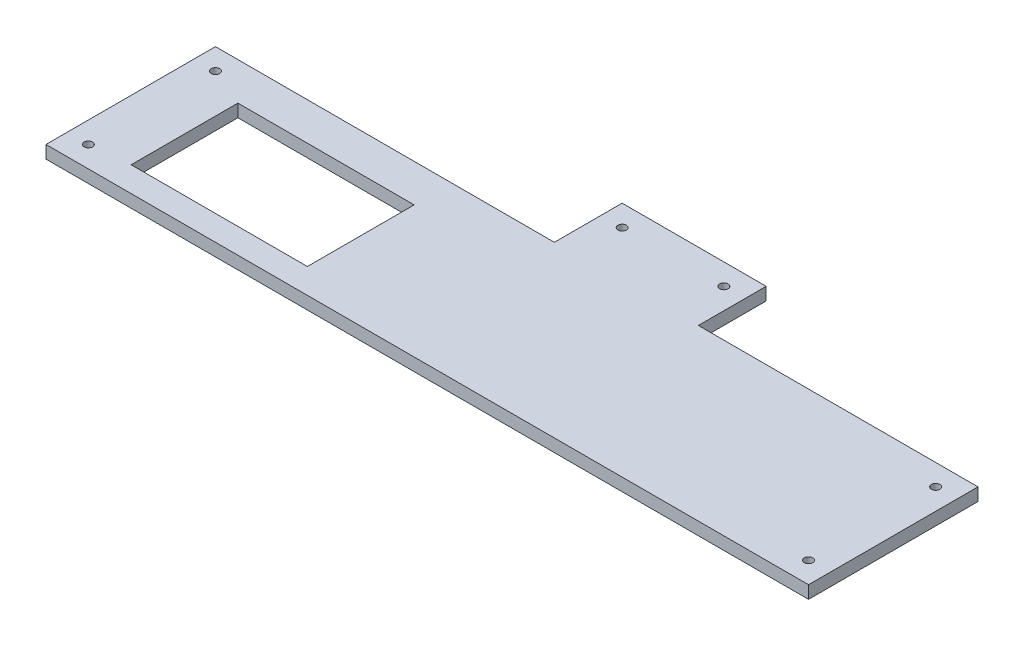
from build123d import *

# Parameters (mm, degrees)
SKETCH1_W              = 900
SKETCH1_H              = 200
SKETCH1_R              = 5
BOSS_EXTRUDE1_DEPTH    = 15
SKETCH2_W              = 208
SKETCH2_H              = 126
SHREDDER_OPENING_DEPTH = 462.221205063
SKETCH3_W              = 170
SKETCH3_H              = 80
SKETCH3_R              = 5
LEGS_ADD_ON_DEPTH      = 15


with BuildPart() as part:
    # Sketch1 → Boss-Extrude1 (new body)
    with BuildSketch(Plane(origin=(0, 0, 0), x_dir=(1, 0, 0), z_dir=(0, 1, 0))):
        Rectangle(SKETCH1_W, SKETCH1_H)
        with Locations(Location((425, -75, 0), (0, 0, 270))):
            Circle(SKETCH1_R, mode=Mode.SUBTRACT)
        with Locations(Location((425, 75, 0), (0, 0, 270))):
            Circle(SKETCH1_R, mode=Mode.SUBTRACT)
        with Locations(Location((-425, -75, 0), (0, 0, 270))):
            Circle(SKETCH1_R, mode=Mode.SUBTRACT)
        with Locations(Location((-425, 75, 0), (0, 0, 270))):
            Circle(SKETCH1_R, mode=Mode.SUBTRACT)
    extrude(amount=-BOSS_EXTRUDE1_DEPTH)

    # Sketch2 → Shredder Opening (cut, through all)
    with BuildSketch(Plane.XZ.offset(15)):
        with Locations((-275, 7.5)):
            Rectangle(SKETCH2_W, SKETCH2_H)
    extrude(amount=-SHREDDER_OPENING_DEPTH, mode=Mode.SUBTRACT)

    # Sketch3 → Legs add on (add, through all)
    with BuildSketch(Plane(origin=(0, 0, 0), x_dir=(1, 0, 0), z_dir=(0, 1, 0))):
        with Locations((35, 140)):
            Rectangle(SKETCH3_W, SKETCH3_H)
        with Locations(Location((95, 155, 0), (0, 0, 270))):
            Circle(SKETCH3_R, mode=Mode.SUBTRACT)
        with Locations(Location((-25, 155, 0), (0, 0, 90))):
            Circle(SKETCH3_R, mode=Mode.SUBTRACT)
    extrude(amount=-LEGS_ADD_ON_DEPTH)


solid = part.part
